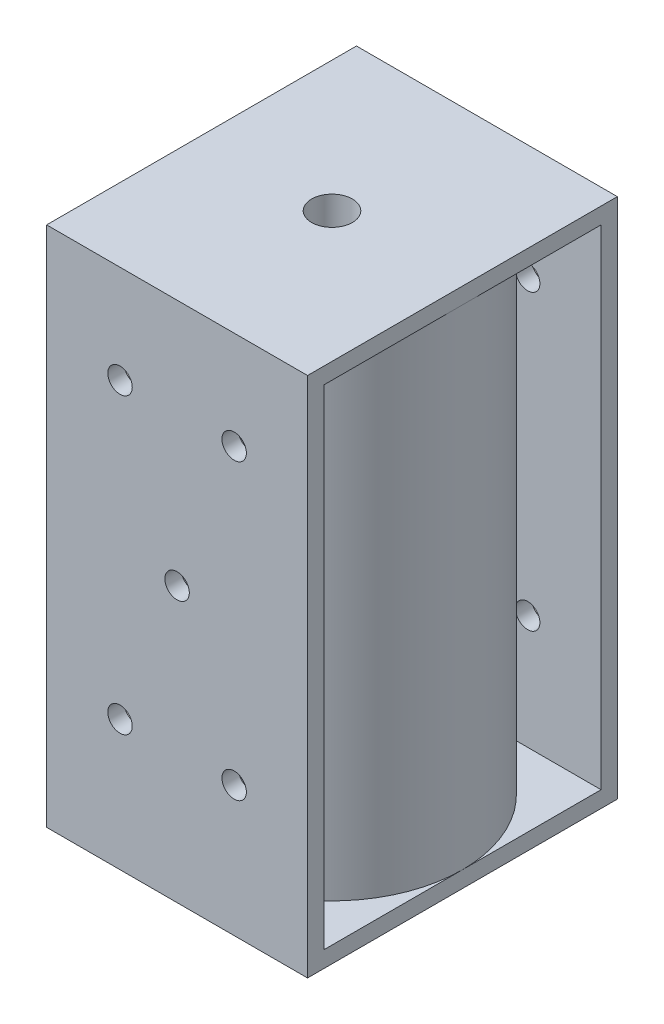
from build123d import *

# Parameters (mm, degrees)
SKETCH1_W           = 38
SKETCH1_H           = 64
SKETCH1_W_2         = 34
SKETCH1_H_2         = 60
BOSS_EXTRUDE1_DEPTH = 32
SKETCH2_R           = 1.5
CUT_EXTRUDE1_DEPTH  = 60.093146811
BOSS_EXTRUDE3_REACH = 74.312
SKETCH7_R           = 16
SKETCH8_R           = 2.5
CUT_EXTRUDE2_DEPTH  = 75.033776076
SKETCH9_R           = 6
CUT_EXTRUDE3_DEPTH  = 40


with BuildPart() as part:
    # Sketch1 → Boss-Extrude1 (new body)
    with BuildSketch(Plane(origin=(0, 0, 0), x_dir=(0, 0, -1), z_dir=(1, 0, 0))):
        Rectangle(SKETCH1_W, SKETCH1_H)
        Rectangle(SKETCH1_W_2, SKETCH1_H_2, mode=Mode.SUBTRACT)
    extrude(amount=BOSS_EXTRUDE1_DEPTH)

    # Sketch2 → Cut-Extrude1 (cut, through all)
    with BuildSketch(Plane.XY.offset(19)):
        with Locations((9, 20)):
            Circle(SKETCH2_R)
        with Locations((23, 20)):
            Circle(SKETCH2_R)
        with Locations((16, 1.663521733)):
            Circle(SKETCH2_R)
        with Locations((9, -16)):
            Circle(SKETCH2_R)
        with Locations((23, -16)):
            Circle(SKETCH2_R)
    extrude(amount=-CUT_EXTRUDE1_DEPTH, mode=Mode.SUBTRACT)

    # Sketch7 → Boss-Extrude3 (add, up to next)
    with BuildSketch(Plane(origin=(0, -30, 0), x_dir=(1, 0, 0), z_dir=(0, 1, 0)), mode=Mode.PRIVATE) as boss_extrude3_sk1:
        with Locations(Location((16, 0, 0), (0, 0, 180))):
            Circle(SKETCH7_R)
    boss_extrude3_tool1 = extrude(boss_extrude3_sk1.sketch, amount=BOSS_EXTRUDE3_REACH, mode=Mode.PRIVATE) - part.part
    add(boss_extrude3_tool1.solids().sort_by_distance((16, -30, 0))[0])

    # Sketch8 → Cut-Extrude2 (cut, through all)
    with BuildSketch(Plane(origin=(0, 32, 0), x_dir=(1, 0, 0), z_dir=(0, 1, 0))):
        with Locations(Location((16, 0, 0), (0, 0, 270))):
            Circle(SKETCH8_R)
    extrude(amount=-CUT_EXTRUDE2_DEPTH, mode=Mode.SUBTRACT)

    # Sketch9 → Cut-Extrude3 (cut)
    with BuildSketch(Plane.XZ.offset(32)):
        with Locations(Location((16, 0, 0), (0, 0, 270))):
            Circle(SKETCH9_R)
    extrude(amount=-CUT_EXTRUDE3_DEPTH, mode=Mode.SUBTRACT)


solid = part.part
